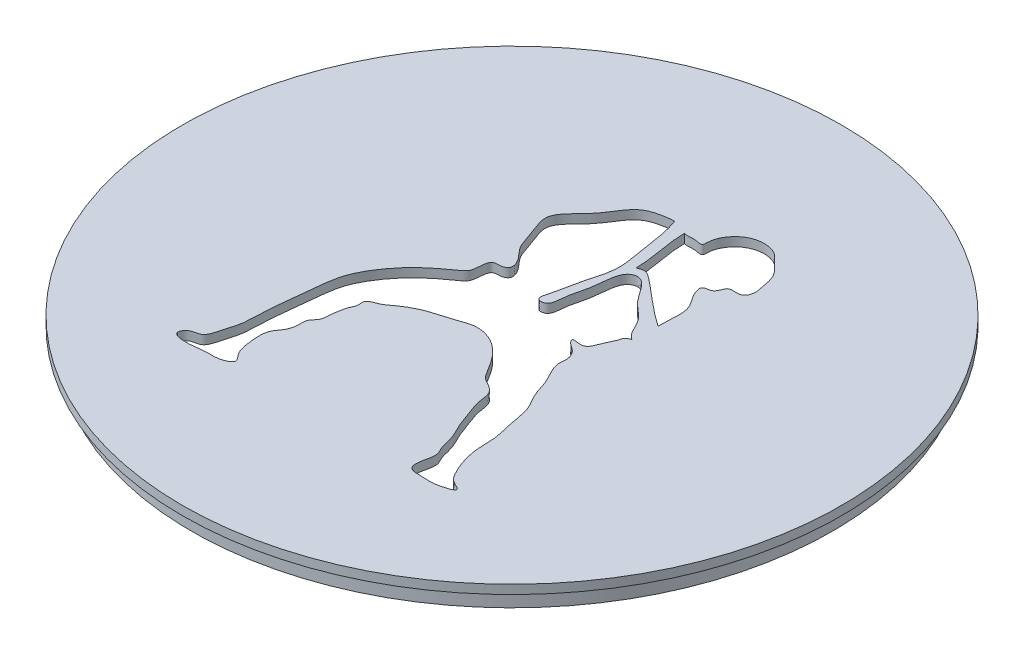
from build123d import *

# Parameters (mm, degrees)
SKETCH_1_R      = 36
EXTRUDE_1_DEPTH = 1
EXTRUDE_START   = 2
SKETCH_2_R      = 36
SKETCH_2_R_2    = 35
EXTRUDE_2_DEPTH = 2
EXTRUDE_START_2 = -1
SKETCH_3_R      = 37
SKETCH_3_R_2    = 36
EXTRUDE_3_DEPTH = 1


with BuildPart() as part:
    # 草图1 → 凸台-拉伸1 (new body)
    with BuildSketch(Plane(origin=(0, 0, 0), x_dir=(1, 0, 0), z_dir=(0, 1, 0))):
        with Locations(Location((35, 20, 0), (0, 0, 270))):
            Circle(SKETCH_1_R)
        with BuildLine():
            add(Edge.make_bspline(
                [(35, 38.258739901), (34.633410358, 38.275292303), (33.648756906, 38.129557348), (31.304085768, 37.538845922), (30.116809269, 34.335682367), (26.764147881, 32.007036994), (28.155102887, 29.129098944), (28.671108002, 26.926027586), (30.029391368, 25.849398624), (30.431543391, 24.614867182), (29.697478915, 24.040650695), (28.587858953, 24.306331755), (28.412525051, 22.971900317), (28.399839911, 21.881807573), (26.522843438, 20.602994913), (24.596117336, 19.062333519), (22.80971293, 16.695757264), (21.504850049, 14.256170002), (21.20836736, 10.606153253), (20.739121073, 7.259344361), (20.734767998, 4.868108115), (20.58068809, 3.550553604), (20.13348083, 2.371159397), (19.767729569, 0.471524993), (18.318157064, 0.587963472), (17.519659112, -0.747085874), (19.679987678, -1.069835858), (21.22834172, -0.617763883), (22.824185925, -0.854573911), (24.273065374, -0.043508374), (23.18821231, 0.968276035), (22.939501713, 2.197054565), (22.770300237, 3.598999888), (22.862473369, 4.926323948), (23.767953582, 5.874370365), (24.007093648, 6.976739166), (23.880395353, 8.080119032), (24.804966211, 8.772623404), (24.708129164, 9.96487246), (24.928348615, 10.822174004), (25.049237011, 11.609746618), (25.500015752, 12.177881506), (25.158296347, 13.273933952), (26.546375668, 13.576947191), (27.69753132, 14.55620871), (29.610686463, 15.666511193), (31.876949735, 16.161236049), (33.779751425, 16.957433012), (35.558571348, 16.753562852), (37.24309792, 15.767593916), (38.384921463, 14.312500731), (39.092400798, 13.091101331), (39.681831696, 12.218974357), (40.535862034, 11.884174201), (41.488111322, 11.08685107), (41.452164184, 9.617433249), (42.148609817, 8.115237976), (42.639322196, 6.37446576), (43.614460484, 4.824981335), (43.786251723, 3.342650731), (44.528833885, 2.126921966), (44.048650315, 0.954303739), (43.993752505, -0.795860267), (45.875356025, -0.697141881), (47.022060959, -0.898025913), (49.523388321, -0.091958702), (47.808762454, 0.469455675), (47.141171046, 1.461525577), (46.473620609, 2.950413704), (45.984495974, 4.886223009), (46.100032136, 7.099932194), (45.381258722, 9.515486899), (45.160704471, 11.77843003), (43.877669435, 13.582373735), (43.499699692, 15.513206741), (42.530276392, 16.84774707), (42.252620293, 18.036652434), (42.496029137, 18.940308464), (41.885145521, 20.110401356), (41.03520154, 20.422572271), (40.580504244, 21.242466332), (42.178146682, 20.663973946), (42.657231039, 21.900896385), (43.011277612, 22.805568845), (43.404249303, 23.471568354), (43.473930796, 24.173521441), (43.937265165, 24.27946204), (44.094595969, 24.374768675)],
                knots=[0.011136532, 0.011136532, 0.011136532, 0.011136532, 0.017894522, 0.028840095, 0.053565641, 0.076394298, 0.090782479, 0.105824611, 0.117198548, 0.122579314, 0.125774425, 0.132433961, 0.138902275, 0.145561811, 0.152221347, 0.177469322, 0.192360498, 0.206081863, 0.227670919, 0.258486171, 0.268312899, 0.271611105, 0.282626246, 0.293056088, 0.300380672, 0.305512958, 0.314184243, 0.327371696, 0.338888629, 0.344534344, 0.349971311, 0.359788281, 0.368495546, 0.375849975, 0.383140359, 0.391480836, 0.39596274, 0.402399004, 0.409753433, 0.41628014, 0.41885768, 0.42425714, 0.428730315, 0.436258061, 0.443934885, 0.458083069, 0.475465075, 0.486740305, 0.49516934, 0.507307465, 0.521590358, 0.528495312, 0.533472976, 0.540377931, 0.544929057, 0.555303454, 0.564763618, 0.575464381, 0.58835208, 0.597645532, 0.602528072, 0.613210558, 0.620250038, 0.62880334, 0.639430809, 0.649602531, 0.655453891, 0.662581643, 0.672715939, 0.684786262, 0.699069154, 0.712776809, 0.730949082, 0.739584237, 0.75267353, 0.76630399, 0.769155091, 0.774753544, 0.782934379, 0.790233963, 0.791484254, 0.79764122, 0.80574885, 0.812136354, 0.816139236, 0.820033244, 0.823536287, 0.823536287, 0.823536287, 0.823536287], degree=3))
            add(Edge.make_bspline(
                [(35, 38.258739901), (35.646586984, 36.494785413), (35.854259651, 33.920456931), (36.618535367, 30.110976977), (35.503955442, 27.120323982), (35.249900164, 24.991471057), (34.621854012, 22.916936973), (36.140808103, 22.969717509), (36.103696368, 25.078160659), (36.812917453, 26.910164273), (36.846057786, 28.996415147), (37.286582676, 30.502554071), (39.089150894, 31.174250644), (40.354614753, 28.190073978), (42.8794243, 26.828060943), (43.340226432, 24.821914631), (44.094595969, 24.374768675)],
                knots=[0, 0, 0, 0, 0.166956262, 0.232571473, 0.34707052, 0.42909929, 0.46518225, 0.483663884, 0.532842766, 0.611756674, 0.673238179, 0.722616848, 0.734591526, 0.836705779, 0.924346435, 1, 1, 1, 1], degree=3))
        make_face(mode=Mode.SUBTRACT)
        with BuildLine():
            add(Edge.make_bspline(
                [(36.71993817, 37.653072256), (36.724570913, 35.436192985), (37.34339497, 33.997633901), (37.355079164, 31.504527216), (37.855863928, 31.785870201), (38.439729709, 31.764865802), (40.731795505, 29.994488362), (42.335980004, 28.428188298), (44.268407222, 27.137601451)],
                knots=[0, 0, 0, 0, 0.408865468, 0.417464776, 0.441782685, 0.484003627, 0.550110082, 1, 1, 1, 1], degree=3))
            add(Edge.make_bspline(
                [(44.268407222, 27.137601451), (44.25337697, 27.653351974), (44.341563782, 28.738016296), (44.437081139, 30.992932856), (42.97685844, 32.16636439), (42.912340862, 33.53840476), (44.257016884, 33.368546972), (44.278868776, 35.161826415), (45.942800667, 34.499626149), (46.536686031, 35.680996628), (46.273294129, 36.963041438), (46.000931438, 38.635417048), (44.692049792, 39.735605729), (43.791596461, 40.794489688), (42.469955821, 41.224519673), (41.065219278, 41.052355135), (39.852561695, 40.261595971), (39.104509797, 39.185963962), (38.870382739, 38.310862093), (38.901564764, 37.347948353), (37.84502449, 37.719378008), (37.194480435, 37.525430197), (36.80146745, 37.625768649), (36.71993817, 37.653072256)],
                knots=[0.840261755, 0.840261755, 0.840261755, 0.840261755, 0.84961404, 0.861989672, 0.878687233, 0.879473273, 0.885978908, 0.893394391, 0.902120847, 0.907245198, 0.913938084, 0.926247826, 0.936822908, 0.94433154, 0.951416806, 0.961312792, 0.969270836, 0.977449049, 0.984312845, 0.986958297, 0.992067555, 0.998355872, 1, 1, 1, 1], degree=3))
        make_face(mode=Mode.SUBTRACT)
    extrude(amount=EXTRUDE_1_DEPTH)

    # 草图2 → 凸台-拉伸2 (add)
    with BuildSketch(Plane(origin=(0, 0, 0), x_dir=(-1, 0, 0), z_dir=(0, -1, 0)).offset(EXTRUDE_START)):
        with Locations(Location((-35, 20, 0), (0, 0, 90))):
            Circle(SKETCH_2_R)
        with Locations(Location((-35, 20, 0), (0, 0, 90))):
            Circle(SKETCH_2_R_2, mode=Mode.SUBTRACT)
    extrude(amount=-EXTRUDE_2_DEPTH)

    # 草图3 → 凸台-拉伸3 (add)
    with BuildSketch(Plane(origin=(0, 1, 0), x_dir=(1, 0, 0), z_dir=(0, 1, 0)).offset(EXTRUDE_START_2)):
        with Locations(Location((35, 20, 0), (0, 0, 270))):
            Circle(SKETCH_3_R)
        with Locations(Location((35, 20, 0), (0, 0, 90))):
            Circle(SKETCH_3_R_2, mode=Mode.SUBTRACT)
    extrude(amount=EXTRUDE_3_DEPTH)


solid = part.part
